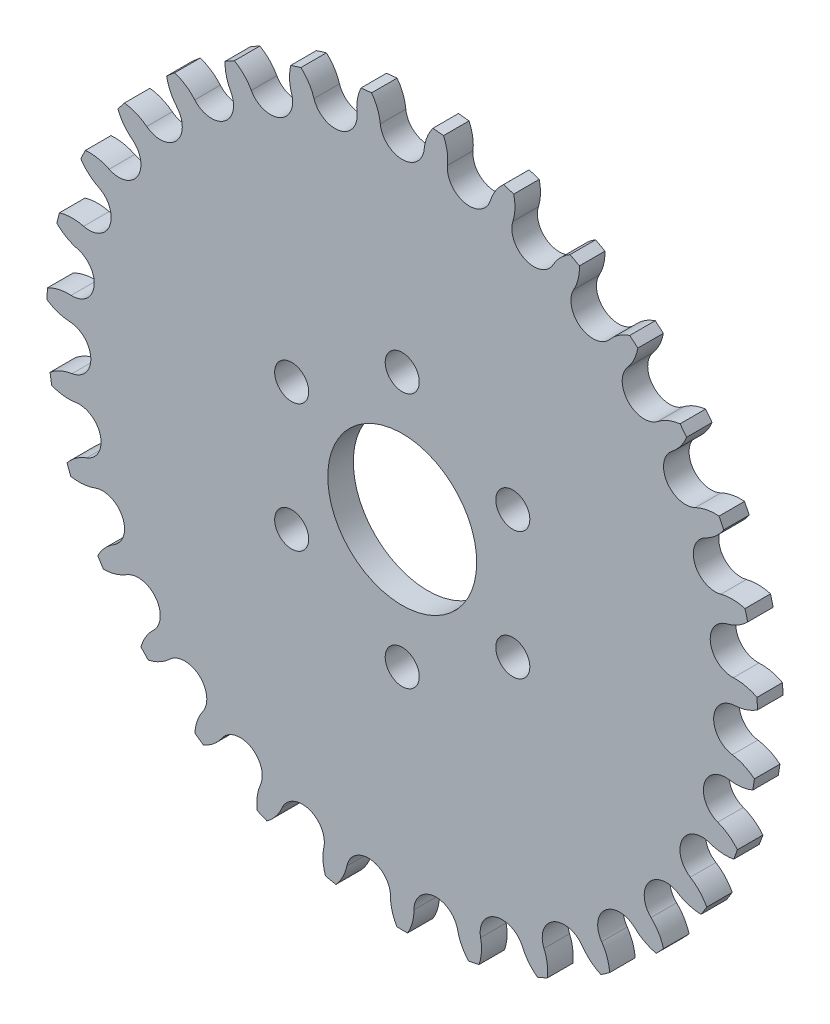
from build123d import *

# Parameters (mm, degrees)
EXTRUDE_1_DEPTH          = 6
PATTERN_CIRCULAR_1_COUNT = 31
SKETCH_3_R               = 17.5
SKETCH_3_R_2             = 4
CUT_EXTRUDE_1_DEPTH      = 119.255759695


with BuildPart() as part:
    # Эскиз2 → Бобышка-Вытянуть1 (new body)
    with BuildSketch(Plane.XY):
        with BuildLine():
            Line((0, 0), (0, 73.278353802))
            ThreePointArc((0, 73.278353802), (3.472593492, 74.614723429), (5.153423095, 77.934301894))
            ThreePointArc((5.153423095, 77.934301894), (5.82212616, 80.719310886), (7.205970043, 83.226982113))
            ThreePointArc((7.205970043, 83.226982113), (8.451435076, 83.109745524), (9.695004918, 82.973872005))
            ThreePointArc((9.695004918, 82.973872005), (10.545730929, 80.23896723), (10.640127414, 77.376358598))
            ThreePointArc((10.640127414, 77.376358598), (11.618324104, 73.786383588), (14.750824175, 71.778341594))
            Line((14.750824175, 71.778341594), (0, 0))
        make_face()
    extrude_1 = extrude(amount=EXTRUDE_1_DEPTH)

    # Круговой массив1: Бобышка-Вытянуть1 ×31 about axis
    pattern_circular_1_axis = Axis((0, 0, 0), (0, 0, 1))
    for i in range(1, PATTERN_CIRCULAR_1_COUNT):
        add(extrude_1.rotate(pattern_circular_1_axis, i * 360 / PATTERN_CIRCULAR_1_COUNT))

    # Эскиз3 → Вырез-Вытянуть1 (cut, through all)
    with BuildSketch(Plane.XY.offset(6)):
        Circle(SKETCH_3_R)
        with Locations((0, 30)):
            Circle(SKETCH_3_R_2)
        with Locations((25.980762114, 15)):
            Circle(SKETCH_3_R_2)
        with Locations((25.980762114, -15)):
            Circle(SKETCH_3_R_2)
        with Locations((0, -30)):
            Circle(SKETCH_3_R_2)
        with Locations((-25.980762114, -15)):
            Circle(SKETCH_3_R_2)
        with Locations((-25.980762114, 15)):
            Circle(SKETCH_3_R_2)
    extrude(amount=-CUT_EXTRUDE_1_DEPTH, mode=Mode.SUBTRACT)


solid = part.part
